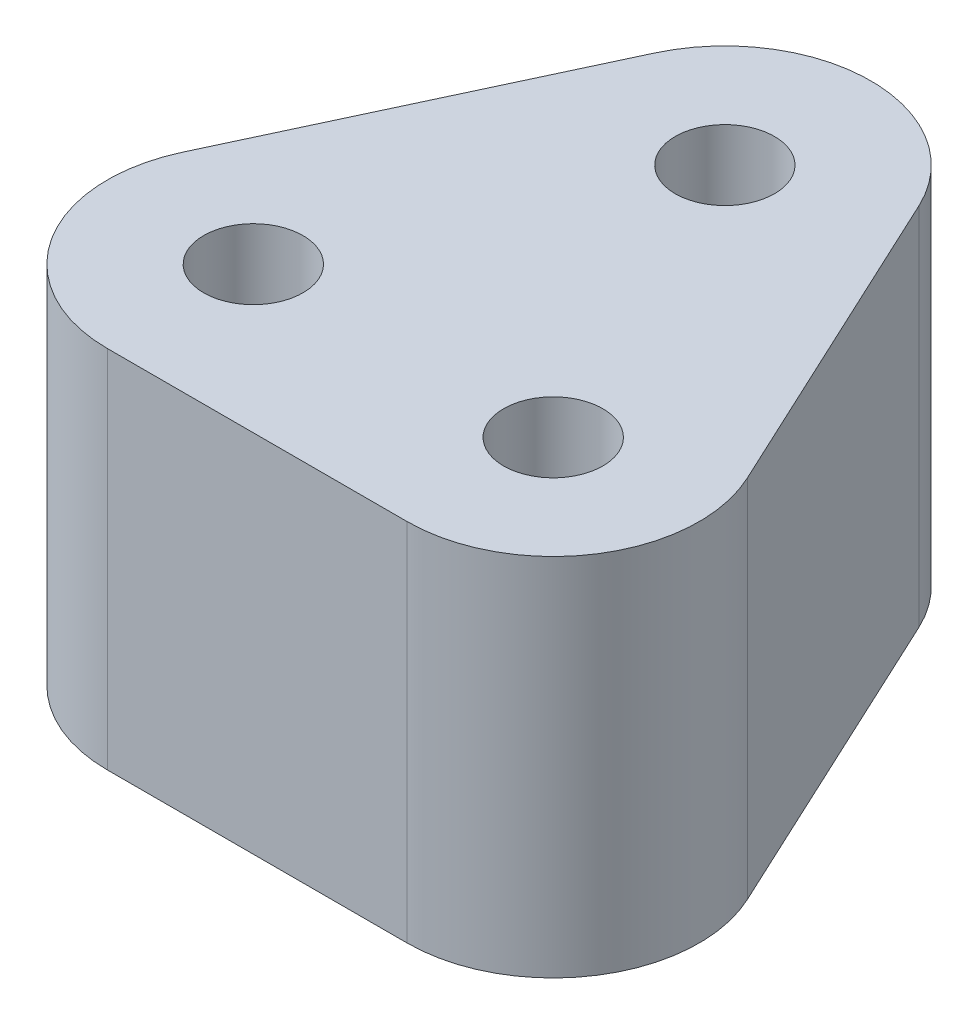
from build123d import *

# Parameters (mm, degrees)
SKETCH_1_R          = 1.7
EXTRUDE_1_DEPTH     = 12.5
FILLET_1_R          = 5
SKETCH_2_R          = 1.7
CUT_EXTRUDE_1_DEPTH = 14


with BuildPart() as part:
    # 草图1 → 凸台-拉伸1 (new body)
    with BuildSketch(Plane(origin=(0, 0, 0), x_dir=(1, 0, 0), z_dir=(0, 1, 0))):
        with BuildLine():
            Line((-12.98390417, -16.013064432), (-4.531538935, 2.113091309))
            ThreePointArc((-4.531538935, 2.113091309), (0, 5), (4.531538935, 2.113091309))
            Line((4.531538935, 2.113091309), (12.98390417, -16.013064432))
            Line((12.98390417, -16.013064432), (-12.98390417, -16.013064432))
        make_face()
        with Locations(Location((0, 0, 0), (0, 0, 270))):
            Circle(SKETCH_1_R, mode=Mode.SUBTRACT)
    extrude(amount=EXTRUDE_1_DEPTH)

    # 圆角1
    fillet_1_edges = [part.edges().sort_by_distance(p)[0] for p in [
        (-12.98390417, 6.25, 16.013064432),
        (12.98390417, 6.25, 16.013064432),
    ]]
    fillet(fillet_1_edges, radius=FILLET_1_R)

    # 草图2 → 切除-拉伸1 (cut)
    with BuildSketch(Plane(origin=(0, 12.5, 0), x_dir=(1, 0, 0), z_dir=(0, 1, 0))):
        with Locations(Location((-5.135476284, -11.013064432, 0), (0, 0, 270))):
            Circle(SKETCH_2_R)
        with Locations(Location((5.135476284, -11.013064432, 0), (0, 0, 270))):
            Circle(SKETCH_2_R)
    extrude(amount=-CUT_EXTRUDE_1_DEPTH, mode=Mode.SUBTRACT)


solid = part.part
